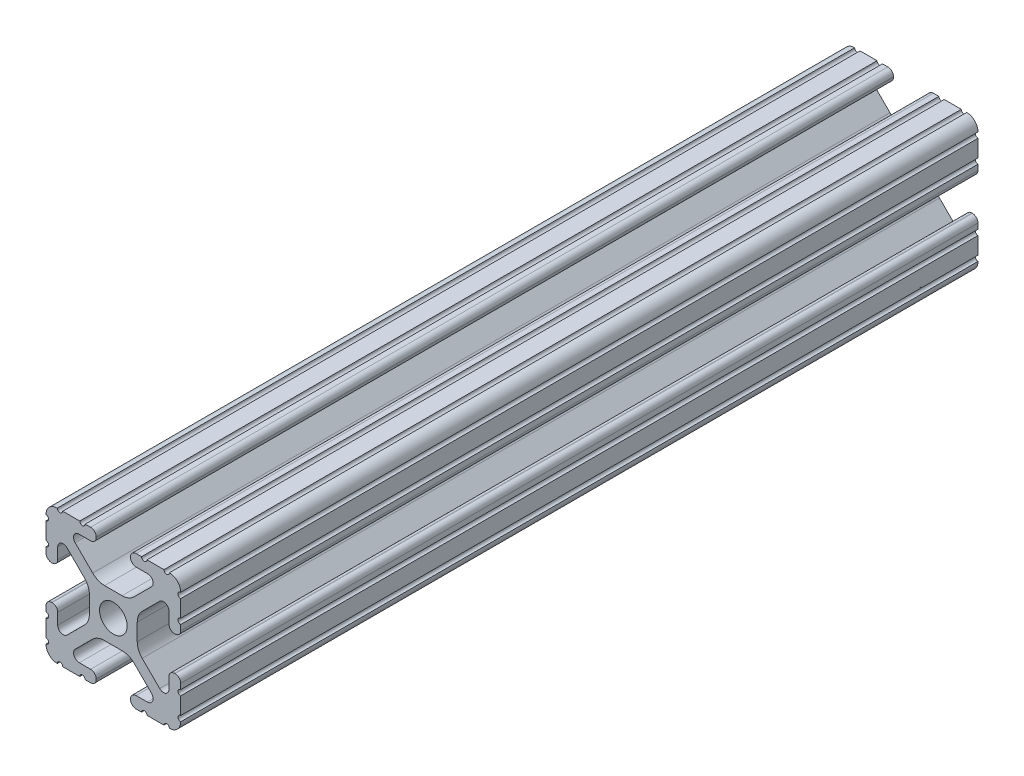
from build123d import *

# Parameters (mm, degrees)
SKETCH1_R           = 2.6035
BOSS_EXTRUDE1_DEPTH = 75.184


with BuildPart() as part:
    # Sketch1 → Boss-Extrude1 (new, symmetric)
    with BuildSketch(Plane.XY):
        with BuildLine():
            Line((-7.179650497, -8.645192506), (-3.952270251, -5.423690499))
            ThreePointArc((-3.952270251, -5.423690499), (-2.922936451, -4.736929036), (-1.709253557, -4.4958))
            Line((-1.709253557, -4.4958), (1.709253557, -4.4958))
            ThreePointArc((1.709253557, -4.4958), (2.922936451, -4.736929036), (3.952270251, -5.423690499))
            Line((3.952270251, -5.423690499), (7.179650497, -8.645192506))
            ThreePointArc((7.179650497, -8.645192506), (7.41473083, -9.822813117), (6.416408329, -10.4902))
            Line((6.416408329, -10.4902), (4.287512407, -10.4902))
            ThreePointArc((4.287512407, -10.4902), (3.54574862, -10.79744862), (3.2385, -11.539212407))
            Line((3.2385, -11.539212407), (3.2385, -11.650987593))
            ThreePointArc((3.2385, -11.650987593), (3.54574862, -12.39275138), (4.287512407, -12.7))
            Line((4.287512407, -12.7), (5.317126718, -12.7))
            ThreePointArc((5.317126718, -12.7), (5.825126718, -12.192), (6.333126718, -12.7))
            Line((6.333126718, -12.7), (9.550443118, -12.7))
            ThreePointArc((9.550443118, -12.7), (10.058366869, -12.192000006), (10.566443095, -12.699847501))
            ThreePointArc((10.566443095, -12.699847501), (12.082537762, -12.08250727), (12.699846982, -10.566399977))
            ThreePointArc((12.699846982, -10.566399977), (12.192000006, -10.058323491), (12.7, -9.5504))
            Line((12.7, -9.5504), (12.7, -6.3330836))
            ThreePointArc((12.7, -6.3330836), (12.192, -5.8250836), (12.7, -5.3170836))
            Line((12.7, -5.3170836), (12.7, -4.287469289))
            ThreePointArc((12.7, -4.287469289), (12.39275138, -3.545705502), (11.650987593, -3.238456882))
            Line((11.650987593, -3.238456882), (11.539212407, -3.238456882))
            ThreePointArc((11.539212407, -3.238456882), (10.79744862, -3.545705502), (10.4902, -4.287469289))
            Line((10.4902, -4.287469289), (10.4902, -6.402089023))
            ThreePointArc((10.4902, -6.402089023), (9.856505071, -7.351067942), (8.737131347, -7.129408934))
            Line((8.737131347, -7.129408934), (5.441005833, -3.840816462))
            ThreePointArc((5.441005833, -3.840816462), (4.750877967, -2.809883091), (4.5085, -1.593185507))
            Line((4.5085, -1.593185507), (4.5085, 1.593185507))
            ThreePointArc((4.5085, 1.593185507), (4.750877967, 2.809883091), (5.441005833, 3.840816462))
            Line((5.441005833, 3.840816462), (8.737131347, 7.129408934))
            ThreePointArc((8.737131347, 7.129408934), (9.856505071, 7.351067942), (10.4902, 6.402089023))
            Line((10.4902, 6.402089023), (10.4902, 4.287469289))
            ThreePointArc((10.4902, 4.287469289), (10.79744862, 3.545705502), (11.539212407, 3.238456882))
            Line((11.539212407, 3.238456882), (11.650987593, 3.238456882))
            ThreePointArc((11.650987593, 3.238456882), (12.39275138, 3.545705502), (12.7, 4.287469289))
            Line((12.7, 4.287469289), (12.7, 5.3170836))
            ThreePointArc((12.7, 5.3170836), (12.192, 5.8250836), (12.7, 6.3330836))
            Line((12.7, 6.3330836), (12.7, 9.5504))
            ThreePointArc((12.7, 9.5504), (12.192000006, 10.058323491), (12.699846982, 10.566399977))
            ThreePointArc((12.699846982, 10.566399977), (12.082537762, 12.08250727), (10.566443095, 12.699847501))
            ThreePointArc((10.566443095, 12.699847501), (10.058366869, 12.192000006), (9.550443118, 12.7))
            Line((9.550443118, 12.7), (6.333126718, 12.7))
            ThreePointArc((6.333126718, 12.7), (5.825126718, 12.192), (5.317126718, 12.7))
            Line((5.317126718, 12.7), (4.287512407, 12.7))
            ThreePointArc((4.287512407, 12.7), (3.54574862, 12.39275138), (3.2385, 11.650987593))
            Line((3.2385, 11.650987593), (3.2385, 11.539212407))
            ThreePointArc((3.2385, 11.539212407), (3.54574862, 10.79744862), (4.287512407, 10.4902))
            Line((4.287512407, 10.4902), (6.476788598, 10.4902))
            ThreePointArc((6.476788598, 10.4902), (7.432222385, 9.85140422), (7.207036008, 8.724370562))
            Line((7.207036008, 8.724370562), (3.898272566, 5.423169045))
            ThreePointArc((3.898272566, 5.423169045), (2.869120213, 4.736787962), (1.655778399, 4.4958))
            Line((1.655778399, 4.4958), (-1.655778399, 4.4958))
            ThreePointArc((-1.655778399, 4.4958), (-2.869120213, 4.736787962), (-3.898272566, 5.423169045))
            Line((-3.898272566, 5.423169045), (-7.207036008, 8.724370562))
            ThreePointArc((-7.207036008, 8.724370562), (-7.432222385, 9.85140422), (-6.476788598, 10.4902))
            Line((-6.476788598, 10.4902), (-4.287512407, 10.4902))
            ThreePointArc((-4.287512407, 10.4902), (-3.54574862, 10.79744862), (-3.2385, 11.539212407))
            Line((-3.2385, 11.539212407), (-3.2385, 11.650987593))
            ThreePointArc((-3.2385, 11.650987593), (-3.54574862, 12.39275138), (-4.287512407, 12.7))
            Line((-4.287512407, 12.7), (-5.317126718, 12.7))
            ThreePointArc((-5.317126718, 12.7), (-5.825126718, 12.192), (-6.333126718, 12.7))
            Line((-6.333126718, 12.7), (-9.550443118, 12.7))
            ThreePointArc((-9.550443118, 12.7), (-10.058366869, 12.192000006), (-10.566443095, 12.699847501))
            ThreePointArc((-10.566443095, 12.699847501), (-12.082537762, 12.08250727), (-12.699846982, 10.566399977))
            ThreePointArc((-12.699846982, 10.566399977), (-12.192000006, 10.058323491), (-12.7, 9.5504))
            Line((-12.7, 9.5504), (-12.7, 6.3330836))
            ThreePointArc((-12.7, 6.3330836), (-12.192, 5.8250836), (-12.7, 5.3170836))
            Line((-12.7, 5.3170836), (-12.7, 4.287469289))
            ThreePointArc((-12.7, 4.287469289), (-12.39275138, 3.545705502), (-11.650987593, 3.238456882))
            Line((-11.650987593, 3.238456882), (-11.539212407, 3.238456882))
            ThreePointArc((-11.539212407, 3.238456882), (-10.79744862, 3.545705502), (-10.4902, 4.287469289))
            Line((-10.4902, 4.287469289), (-10.4902, 6.402089023))
            ThreePointArc((-10.4902, 6.402089023), (-9.856505071, 7.351067942), (-8.737131347, 7.129408934))
            Line((-8.737131347, 7.129408934), (-5.441005833, 3.840816462))
            ThreePointArc((-5.441005833, 3.840816462), (-4.750877967, 2.809883091), (-4.5085, 1.593185507))
            Line((-4.5085, 1.593185507), (-4.5085, -1.593185507))
            ThreePointArc((-4.5085, -1.593185507), (-4.750877967, -2.809883091), (-5.441005833, -3.840816462))
            Line((-5.441005833, -3.840816462), (-8.737131347, -7.129408934))
            ThreePointArc((-8.737131347, -7.129408934), (-9.856505071, -7.351067942), (-10.4902, -6.402089023))
            Line((-10.4902, -6.402089023), (-10.4902, -4.287469289))
            ThreePointArc((-10.4902, -4.287469289), (-10.79744862, -3.545705502), (-11.539212407, -3.238456882))
            Line((-11.539212407, -3.238456882), (-11.650987593, -3.238456882))
            ThreePointArc((-11.650987593, -3.238456882), (-12.39275138, -3.545705502), (-12.7, -4.287469289))
            Line((-12.7, -4.287469289), (-12.7, -5.3170836))
            ThreePointArc((-12.7, -5.3170836), (-12.192, -5.8250836), (-12.7, -6.3330836))
            Line((-12.7, -6.3330836), (-12.7, -9.5504))
            ThreePointArc((-12.7, -9.5504), (-12.192000006, -10.058323491), (-12.699846982, -10.566399977))
            ThreePointArc((-12.699846982, -10.566399977), (-12.082537762, -12.08250727), (-10.566443095, -12.699847501))
            ThreePointArc((-10.566443095, -12.699847501), (-10.058366869, -12.192000006), (-9.550443118, -12.7))
            Line((-9.550443118, -12.7), (-6.333126718, -12.7))
            ThreePointArc((-6.333126718, -12.7), (-5.825126718, -12.192), (-5.317126718, -12.7))
            Line((-5.317126718, -12.7), (-4.287512407, -12.7))
            ThreePointArc((-4.287512407, -12.7), (-3.54574862, -12.39275138), (-3.2385, -11.650987593))
            Line((-3.2385, -11.650987593), (-3.2385, -11.539212407))
            ThreePointArc((-3.2385, -11.539212407), (-3.54574862, -10.79744862), (-4.287512407, -10.4902))
            Line((-4.287512407, -10.4902), (-6.416408329, -10.4902))
            ThreePointArc((-6.416408329, -10.4902), (-7.41473083, -9.822813117), (-7.179650497, -8.645192506))
        make_face()
        Circle(SKETCH1_R, mode=Mode.SUBTRACT)
    extrude(amount=BOSS_EXTRUDE1_DEPTH, both=True)


solid = part.part
